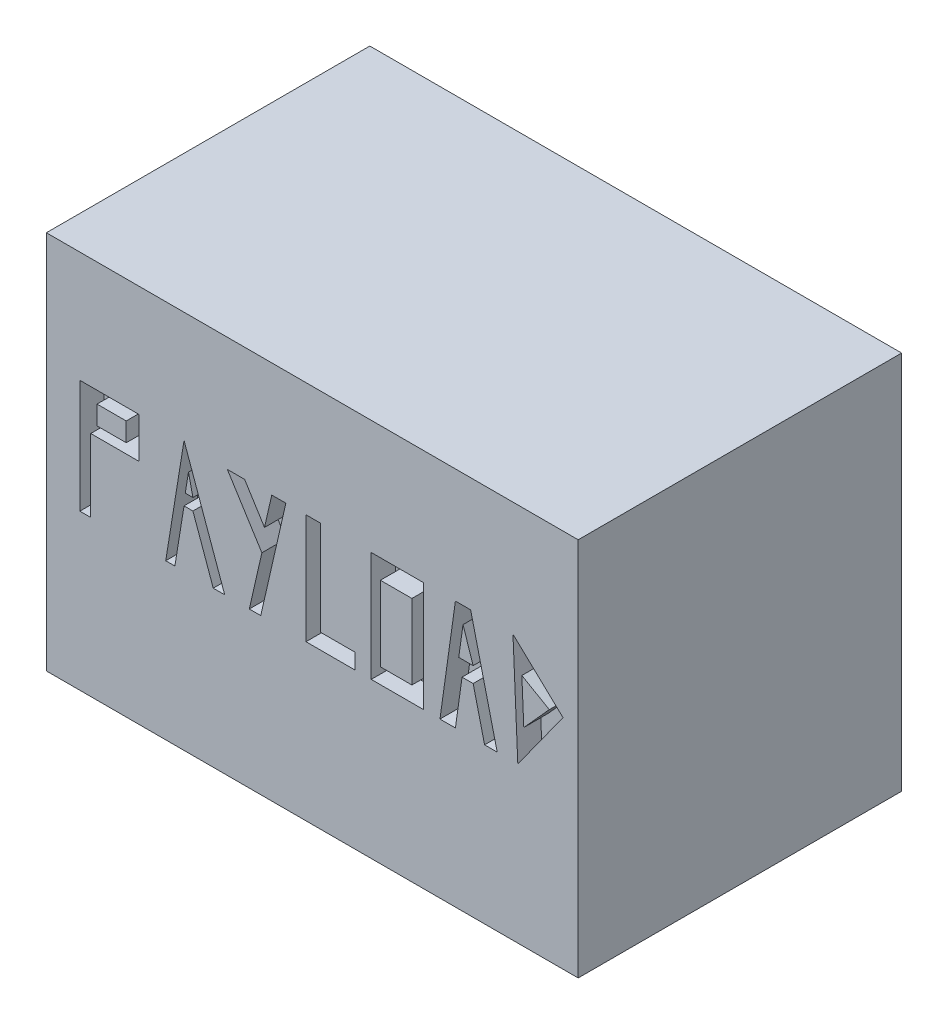
from build123d import *

# Parameters (mm, degrees)
SKETCH1_W           = 558.8
SKETCH1_H           = 398.78
BOSS_EXTRUDE1_DEPTH = 339.852
SKETCH2_W           = 30.678718516
SKETCH2_H           = 19.85093551
SKETCH2_W_2         = 54.740458529
SKETCH2_H_2         = 115.513846454
SKETCH2_W_3         = 33.084892517
SKETCH2_H_3         = 78.80219854
CUT_EXTRUDE1_DEPTH  = 25.4


with BuildPart() as part:
    # Sketch1 → Boss-Extrude1 (new body)
    with BuildSketch(Plane.XY):
        Rectangle(SKETCH1_W, SKETCH1_H)
    extrude(amount=-BOSS_EXTRUDE1_DEPTH)

    # Sketch2 → Cut-Extrude1 (cut)
    # profile 1 of 7: a face of its own
    with BuildSketch(Plane.XY):
        Polygon((-244.226661127, 82.712231293), (-244.226661127, -36.393381769), (-232.797334621, -36.393381769), (-232.797334621, 40.002642771), (-182.267680595, 40.002642771), (-182.267680595, 82.712231293), align=None)
        with Locations((-210.840996859, 60.154350031)):
            Rectangle(SKETCH2_W, SKETCH2_H, mode=Mode.SUBTRACT)
    # profile 2 of 7: a face of its own
    with BuildSketch(Plane.XY):
        Polygon((-153.99513608, -36.393381769), (-134.74574407, 82.712231293), (-92.036155548, -36.393381769), (-104.067025554, -36.393381769), (-125.421819815, 23.159424762), (-134.74574407, 23.159424762), (-144.370440075, -36.393381769), align=None)
        Polygon((-130.083781942, 56.244317279), (-133.454387424, 35.388695861), (-125.421819815, 35.388695861), align=None, mode=Mode.SUBTRACT)
    # profile 3 of 7: a face of its own
    with BuildSketch(Plane.XY):
        Polygon((-27.74569837, 79.120464685), (-54.138915028, -36.393381769), (-66.169785034, -36.393381769), (-52.973176705, 21.363541458), (-89.245743132, 79.120464685), (-71.109459919, 79.120464685), (-50.193871527, 45.81650657), (-42.584406436, 79.120464685), align=None)
    # profile 4 of 7: a face of its own
    with BuildSketch(Plane.XY):
        Polygon((-6.616978503, 79.120464685), (-6.616978503, -36.393381769), (44.683403133, -36.393381769), (44.683403133, -20.15170726), (8.421609004, -20.15170726), (8.421609004, 79.120464685), align=None)
    # profile 5 of 7: a face of its own
    with BuildSketch(Plane.XY):
        with Locations((89.329209797, 21.363541458)):
            Rectangle(SKETCH2_W_2, SKETCH2_H_2)
        with Locations((88.126122796, 19.24939201)):
            Rectangle(SKETCH2_W_3, SKETCH2_H_3, mode=Mode.SUBTRACT)
    # profile 6 of 7: a face of its own
    with BuildSketch(Plane.XY):
        Polygon((150.385875078, 79.120464685), (134.14420057, -36.393381769), (150.385875078, -36.393381769), (157.386476137, 13.396210762), (169.033723588, 13.396210762), (181.064593594, -36.393381769), (194.298550601, -36.393381769), (166.386450903, 79.120464685), align=None)
        Polygon((158.386162991, 61.658208782), (153.886175607, 29.653451429), (169.033723588, 29.653451429), align=None, mode=Mode.SUBTRACT)
    # profile 7 of 7: a face of its own
    with BuildSketch(Plane.XY):
        Polygon((210.874736117, 79.120464685), (215.954116612, -36.393381769), (263.476053137, 29.653451429), align=None)
        Polygon((220.207882974, 46.326740486), (222.244964668, 0), (249.039009129, 29.653451429), align=None, mode=Mode.SUBTRACT)
    extrude(amount=-CUT_EXTRUDE1_DEPTH, mode=Mode.SUBTRACT)


solid = part.part
